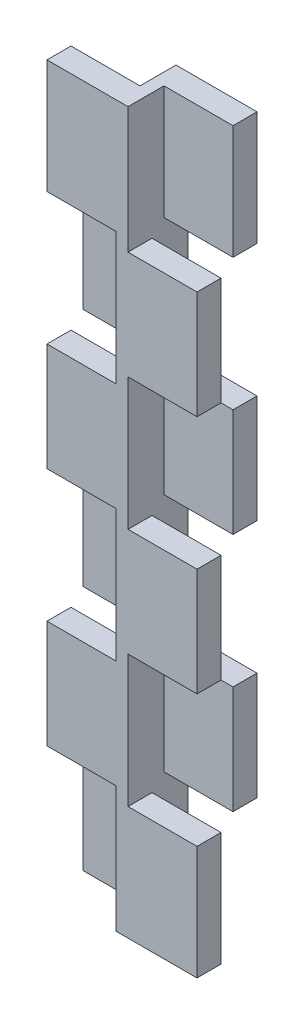
from build123d import *

# Parameters (mm, degrees)
SKETCH1_W           = 0.25
SKETCH1_H           = 1.2
BOSS_EXTRUDE1_DEPTH = 0.1
CUT_EXTRUDE1_DEPTH  = 0.115
CUT_EXTRUDE2_DEPTH  = 0.115


with BuildPart() as part:
    # Sketch1 → Boss-Extrude1 (new body)
    with BuildSketch(Plane.XY):
        with Locations((0.125, 0.6)):
            Rectangle(SKETCH1_W, SKETCH1_H)
    extrude(amount=BOSS_EXTRUDE1_DEPTH)

    # Sketch2 → Cut-Extrude1 (cut)
    with BuildSketch(Plane(origin=(0.25, 0, 0), x_dir=(0, 0, -1), z_dir=(1, 0, 0))):
        Polygon((-0.04, 1.2), (-0.1, 1.2), (-0.1, 0.99), (-0.06, 0.99), (-0.06, 0.81), (-0.1, 0.81), (-0.1, 0.59), (-0.06, 0.59), (-0.06, 0.41), (-0.1, 0.41), (-0.1, 0.19), (-0.06, 0.19), (-0.06, 0), (0, 0), (0, 0.21), (-0.04, 0.21), (-0.04, 0.39), (0, 0.39), (0, 0.61), (-0.04, 0.61), (-0.04, 0.79), (0, 0.79), (0, 1.01), (-0.04, 1.01), align=None)
    extrude(amount=-CUT_EXTRUDE1_DEPTH, mode=Mode.SUBTRACT)

    # Sketch3 → Cut-Extrude2 (cut)
    with BuildSketch(Plane.ZY):
        Polygon((0.06, 1.01), (0.06, 1.2), (0, 1.2), (0, 0.99), (0.04, 0.99), (0.04, 0.81), (0, 0.81), (0, 0.59), (0.04, 0.59), (0.04, 0.41), (0, 0.41), (0, 0.19), (0.04, 0.19), (0.04, 0), (0.1, 0), (0.1, 0.21), (0.06, 0.21), (0.06, 0.39), (0.1, 0.39), (0.1, 0.61), (0.06, 0.61), (0.06, 0.79), (0.1, 0.79), (0.1, 1.01), align=None)
    extrude(amount=-CUT_EXTRUDE2_DEPTH, mode=Mode.SUBTRACT)


solid = part.part
